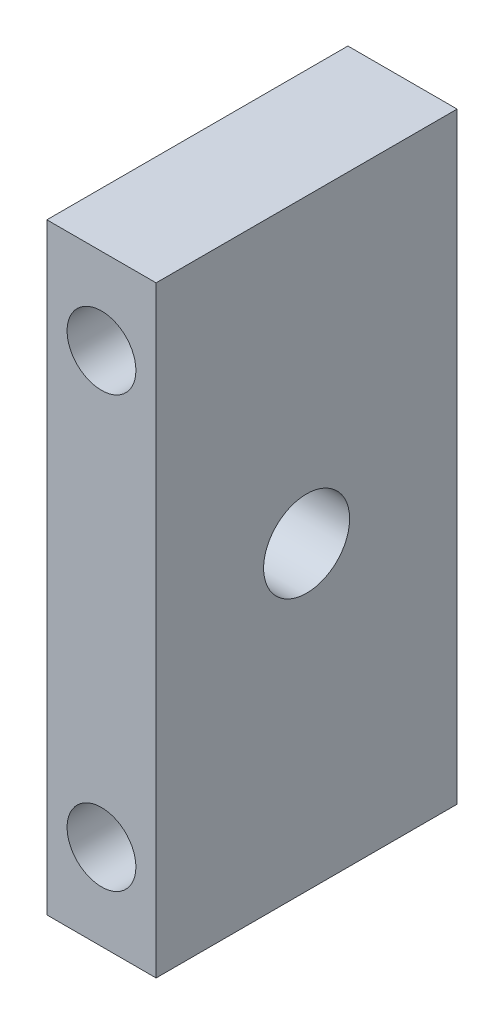
from build123d import *

# Parameters (mm, degrees)
CROQUIS1_W                    = 35
CROQUIS1_H                    = 70
CROQUIS1_R                    = 5
SALIENTE_EXTRUIR1_DEPTH       = 6.35
DI_METRO_DE_TALADRO_5_0_5_1_D = 8


with BuildPart() as part:
    # Croquis1 → Saliente-Extruir1 (new, symmetric)
    with BuildSketch(Plane(origin=(0, 0, 0), x_dir=(0, 0, -1), z_dir=(1, 0, 0))):
        Rectangle(CROQUIS1_W, CROQUIS1_H)
        Circle(CROQUIS1_R, mode=Mode.SUBTRACT)
    extrude(amount=SALIENTE_EXTRUIR1_DEPTH, both=True)

    # Diámetro de taladro Ø5.0 (5)1 (through all)
    with Locations(Plane.XY.offset(17.5)):
        with Locations((0, 25), (0, -25)):
            Hole(DI_METRO_DE_TALADRO_5_0_5_1_D / 2)


solid = part.part
